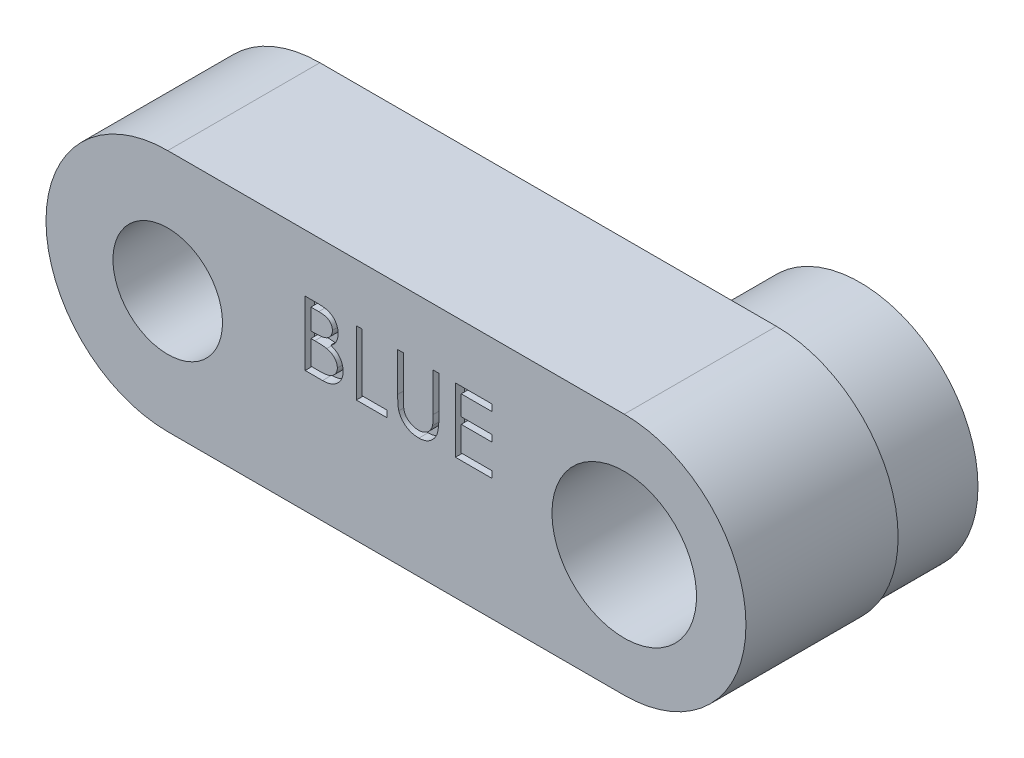
from build123d import *

# Parameters (mm, degrees)
SKETCH1_R           = 1.8
SKETCH1_R_2         = 1.45
BOSS_EXTRUDE1_DEPTH = 2.5
CUT_EXTRUDE2_DEPTH  = 0.3
SKETCH14_R          = 2.375
CUT_EXTRUDE12_DEPTH = 14.162446737
BOSS_EXTRUDE2_START = 2.75
SKETCH17_R          = 3.875
SKETCH17_R_2        = 2.375
BOSS_EXTRUDE2_DEPTH = 2.75
SKETCH18_R          = 2.375
SKETCH18_R_2        = 1.375
BOSS_EXTRUDE3_DEPTH = 0.8


with BuildPart() as part:
    # Sketch1 → Boss-Extrude1 (new, symmetric)
    with BuildSketch(Plane.XY):
        with BuildLine():
            Line((-7.5, 4), (7.5, 4))
            ThreePointArc((7.5, 4), (11.5, 0), (7.5, -4))
            Line((7.5, -4), (-7.5, -4))
            ThreePointArc((-7.5, -4), (-11.5, 0), (-7.5, 4))
        make_face()
        with Locations((-7.5, 0)):
            Circle(SKETCH1_R, mode=Mode.SUBTRACT)
        with Locations((7.5, 0)):
            Circle(SKETCH1_R_2, mode=Mode.SUBTRACT)
    extrude(amount=BOSS_EXTRUDE1_DEPTH, both=True)

    # Sketch3 → Cut-Extrude2 (cut)
    # profile 1 of 4: a face of its own
    with BuildSketch(Plane.XY.offset(2.5)):
        with BuildLine():
            Line((-2.985042735, 2.116666667), (-2.572055288, 2.116666667))
            add(Edge.make_bspline(
                [(-2.572055288, 2.116666667), (-2.551839018, 2.11656038), (-2.512654855, 2.116354369), (-2.455674526, 2.113159332), (-2.402305007, 2.108802827), (-2.352530821, 2.101890342), (-2.306374968, 2.093549601), (-2.263698349, 2.083448979), (-2.224636674, 2.071337646), (-2.178001828, 2.052078228), (-2.124830762, 2.023458979), (-2.067258401, 1.981168846), (-2.018028218, 1.929442071), (-1.975582207, 1.871093037), (-1.941835816, 1.806906165), (-1.917422002, 1.738411322), (-1.901965573, 1.666491983), (-1.900375996, 1.6171173), (-1.89957265, 1.592164129)],
                knots=[0, 0, 0, 0, 1.001505555, 1.941167018, 2.826882275, 3.653841531, 4.429895133, 5.150066043, 5.825578002, 6.45369114, 7.647487171, 8.808567382, 9.977351308, 11.170798116, 12.373658725, 13.556498008, 14.765093433, 16, 16, 16, 16], degree=3))
            add(Edge.make_bspline(
                [(-1.89957265, 1.592164129), (-1.900233786, 1.568788536), (-1.901532983, 1.522853291), (-1.913956461, 1.455667806), (-1.933406008, 1.391713497), (-1.96044204, 1.331223769), (-1.995579914, 1.275565346), (-2.037222802, 1.224289237), (-2.087464487, 1.179566455), (-2.125106827, 1.154563843), (-2.144227431, 1.141863649)],
                knots=[0, 0, 0, 0, 1.044552857, 2.05264487, 3.044412934, 4.028983338, 5.005914585, 5.980388656, 6.974128949, 8, 8, 8, 8], degree=3))
            add(Edge.make_bspline(
                [(-2.144227431, 1.141863649), (-2.120181839, 1.132631959), (-2.074176665, 1.114969449), (-2.010866552, 1.083742288), (-1.956320146, 1.049777583), (-1.910118063, 1.012686416), (-1.870604338, 0.972706326), (-1.836100892, 0.92925109), (-1.806660252, 0.881753841), (-1.781433865, 0.830709799), (-1.761749617, 0.776640172), (-1.747007999, 0.720052132), (-1.738561018, 0.661148591), (-1.737358968, 0.621061719), (-1.736752137, 0.600824653)],
                knots=[0, 0, 0, 0, 1.27268992, 2.434971085, 3.483601985, 4.442670788, 5.356604649, 6.2567628, 7.179492994, 8.113709626, 9.066344395, 10.018646069, 10.999752585, 12, 12, 12, 12], degree=3))
            add(Edge.make_bspline(
                [(-1.736752137, 0.600824653), (-1.737342896, 0.58016183), (-1.738505231, 0.539507148), (-1.747080738, 0.479783804), (-1.761600531, 0.422709432), (-1.781600701, 0.367914869), (-1.807703624, 0.315506121), (-1.839470536, 0.265423814), (-1.87734772, 0.218171147), (-1.919719074, 0.173223051), (-1.9676538, 0.132808151), (-2.019370471, 0.096815319), (-2.075520388, 0.067214605), (-2.135181356, 0.042349202), (-2.199022633, 0.023355325), (-2.266757543, 0.010067149), (-2.338327668, 0.001113627), (-2.387440232, 0.000377508), (-2.41262687, 0)],
                knots=[0, 0, 0, 0, 0.978564426, 1.925352924, 2.850884081, 3.763762016, 4.682927383, 5.618979971, 6.567305752, 7.547517671, 8.540179244, 9.531824382, 10.526200242, 11.540722885, 12.589160233, 13.674978461, 14.80764778, 16, 16, 16, 16], degree=3))
            Line((-2.41262687, 0), (-2.985042735, 0))
            Line((-2.985042735, 0), (-2.985042735, 2.116666667))
        make_face()
        with BuildLine():
            Line((-2.79508547, 1.89957265), (-2.79508547, 1.221153846))
            Line((-2.79508547, 1.221153846), (-2.667457933, 1.221153846))
            add(Edge.make_bspline(
                [(-2.667457933, 1.221153846), (-2.648801756, 1.221395704), (-2.612754222, 1.221863024), (-2.560551237, 1.223201674), (-2.512094678, 1.226950015), (-2.467468189, 1.230697278), (-2.426742044, 1.236790005), (-2.390006471, 1.244042384), (-2.356684938, 1.251712522), (-2.318258642, 1.264756926), (-2.274671668, 1.28403533), (-2.228205934, 1.313954011), (-2.187242707, 1.349589215), (-2.152652027, 1.390707559), (-2.124342233, 1.435983776), (-2.104679176, 1.484695461), (-2.091345819, 1.535628588), (-2.090141416, 1.570594865), (-2.089529915, 1.588348024)],
                knots=[0, 0, 0, 0, 1.156816544, 2.235205308, 3.236616184, 4.169592532, 5.011045266, 5.787822928, 6.49130361, 7.128639758, 8.301311294, 9.436451833, 10.541879658, 11.654887649, 12.756523258, 13.837046038, 14.901820046, 16, 16, 16, 16], degree=3))
            add(Edge.make_bspline(
                [(-2.089529915, 1.588348024), (-2.089848128, 1.60009599), (-2.090472339, 1.623140909), (-2.095584575, 1.656735043), (-2.104273536, 1.688330074), (-2.11543399, 1.718358988), (-2.131030006, 1.745882821), (-2.149392672, 1.77185323), (-2.17157878, 1.795385797), (-2.196832012, 1.817380684), (-2.225865798, 1.836880946), (-2.258662818, 1.853959884), (-2.295666794, 1.867712639), (-2.336254092, 1.87975717), (-2.381049464, 1.888216757), (-2.429535979, 1.895264282), (-2.482110786, 1.898852178), (-2.518484252, 1.899327136), (-2.537286325, 1.89957265)],
                knots=[0, 0, 0, 0, 0.91205012, 1.789085906, 2.630437955, 3.453916878, 4.269457761, 5.079663411, 5.91843418, 6.774407191, 7.675494373, 8.627863946, 9.638891023, 10.736472738, 11.911756761, 13.175263542, 14.539845004, 16, 16, 16, 16], degree=3))
            Line((-2.537286325, 1.89957265), (-2.79508547, 1.89957265))
        make_face(mode=Mode.SUBTRACT)
        with BuildLine():
            Line((-2.79508547, 1.004059829), (-2.79508547, 0.217094017))
            Line((-2.79508547, 0.217094017), (-2.524565972, 0.217094017))
            add(Edge.make_bspline(
                [(-2.524565972, 0.217094017), (-2.505202146, 0.217326093), (-2.467880923, 0.217773388), (-2.413995893, 0.219233619), (-2.364052778, 0.222555138), (-2.318279477, 0.227783819), (-2.276181727, 0.233455547), (-2.238264544, 0.24108237), (-2.204220565, 0.249820551), (-2.164745151, 0.263327407), (-2.120293029, 0.284310511), (-2.072389321, 0.315948162), (-2.029798227, 0.353638925), (-1.993630284, 0.397260954), (-1.963989096, 0.444693232), (-1.942426035, 0.494976372), (-1.929126803, 0.547279525), (-1.927516824, 0.582940346), (-1.926709402, 0.600824653)],
                knots=[0, 0, 0, 0, 1.160039823, 2.235823828, 3.228722157, 4.157150951, 4.99529583, 5.772374946, 6.472645482, 7.099169577, 8.269452708, 9.405989375, 10.527446681, 11.663510218, 12.788923519, 13.866172445, 14.929861265, 16, 16, 16, 16], degree=3))
            add(Edge.make_bspline(
                [(-1.926709402, 0.600824653), (-1.926876379, 0.612008721), (-1.927207641, 0.634196456), (-1.932203346, 0.66680269), (-1.939468876, 0.698386908), (-1.948861696, 0.729034875), (-1.962541088, 0.758192489), (-1.978510761, 0.786436417), (-1.997235037, 0.813803998), (-2.02641127, 0.848403789), (-2.068848613, 0.888267888), (-2.129147473, 0.92729771), (-2.19771072, 0.958774241), (-2.247438775, 0.972139163), (-2.273127003, 0.979043136)],
                knots=[0, 0, 0, 0, 0.723448775, 1.435228256, 2.130040452, 2.821711965, 3.505591119, 4.210454504, 4.921174351, 5.648778258, 7.137944449, 8.670945889, 10.280296675, 12, 12, 12, 12], degree=3))
            add(Edge.make_bspline(
                [(-2.273127003, 0.979043136), (-2.283425552, 0.981132639), (-2.305754929, 0.985663113), (-2.34216618, 0.99044539), (-2.383735015, 0.994705974), (-2.430557422, 0.997857484), (-2.48269264, 1.00111506), (-2.540252014, 1.002381928), (-2.603000486, 1.003893386), (-2.64653873, 1.004002929), (-2.66915398, 1.004059829)],
                knots=[0, 0, 0, 0, 0.634451884, 1.375622551, 2.216452059, 3.157844607, 4.20941857, 5.370758133, 6.634282058, 8, 8, 8, 8], degree=3))
            Line((-2.66915398, 1.004059829), (-2.79508547, 1.004059829))
        make_face(mode=Mode.SUBTRACT)
    # profile 2 of 4: a face of its own
    with BuildSketch(Plane.XY.offset(2.5)):
        Polygon((-1.302564103, 2.116666667), (-1.112606838, 2.116666667), (-1.112606838, 0.217094017), (-0.298504274, 0.217094017), (-0.298504274, 0), (-1.302564103, 0), align=None)
    # profile 3 of 4: a face of its own
    with BuildSketch(Plane.XY.offset(2.5)):
        with BuildLine():
            Line((0.054273504, 2.116666667), (0.244230769, 2.116666667))
            Line((0.244230769, 2.116666667), (0.244230769, 0.848447516))
            add(Edge.make_bspline(
                [(0.244230769, 0.848447516), (0.2442025, 0.830497738), (0.244148855, 0.79643494), (0.244507185, 0.747952206), (0.245510708, 0.704849338), (0.246143385, 0.66696019), (0.247550868, 0.634458623), (0.248698734, 0.607168554), (0.25017469, 0.585219203), (0.251948528, 0.572409786), (0.252711004, 0.566903713)],
                knots=[0, 0, 0, 0, 1.528628734, 2.90083645, 4.128790002, 5.200304208, 6.127813768, 6.898992206, 7.526736466, 8, 8, 8, 8], degree=3))
            add(Edge.make_bspline(
                [(0.252711004, 0.566903713), (0.255842134, 0.547039241), (0.261927966, 0.508429591), (0.277437918, 0.453451725), (0.299098978, 0.403902701), (0.324766914, 0.358236348), (0.358592826, 0.317723735), (0.399114012, 0.280402879), (0.448207234, 0.247762787), (0.50279341, 0.217917296), (0.561627815, 0.193929365), (0.621747962, 0.175790521), (0.682250145, 0.164736139), (0.722754778, 0.163456137), (0.74286859, 0.162820513)],
                knots=[0, 0, 0, 0, 1.035780045, 2.013197591, 2.933192213, 3.817615948, 4.702609284, 5.640816605, 6.646850145, 7.73207398, 8.84249596, 9.914020372, 10.964143139, 12, 12, 12, 12], degree=3))
            add(Edge.make_bspline(
                [(0.74286859, 0.162820513), (0.760136804, 0.163469937), (0.794573496, 0.164765033), (0.845740243, 0.172785041), (0.895572689, 0.187239193), (0.94431691, 0.205889904), (0.990007267, 0.230532495), (1.032669254, 0.258999145), (1.070747442, 0.29238858), (1.105495851, 0.329339741), (1.135755074, 0.371031905), (1.161984288, 0.416557256), (1.183469017, 0.466600908), (1.194078672, 0.501770487), (1.199529247, 0.519838408)],
                knots=[0, 0, 0, 0, 0.994687771, 1.983630487, 2.973142513, 3.978332533, 4.983357753, 5.956394766, 6.925816176, 7.893390482, 8.871859704, 9.88551698, 10.913711441, 12, 12, 12, 12], degree=3))
            add(Edge.make_bspline(
                [(1.199529247, 0.519838408), (1.201343608, 0.527306355), (1.205386737, 0.543947952), (1.209164712, 0.572082256), (1.21309961, 0.605277252), (1.21582985, 0.643771444), (1.218491541, 0.687435842), (1.220083923, 0.736497912), (1.220819938, 0.790779502), (1.221039273, 0.828660071), (1.221153846, 0.848447516)],
                knots=[0, 0, 0, 0, 0.558680831, 1.244966039, 2.062412453, 2.990489873, 4.051219941, 5.244515665, 6.560634259, 8, 8, 8, 8], degree=3))
            Line((1.221153846, 0.848447516), (1.221153846, 2.116666667))
            Line((1.221153846, 2.116666667), (1.411111111, 2.116666667))
            Line((1.411111111, 2.116666667), (1.411111111, 0.838271234))
            add(Edge.make_bspline(
                [(1.411111111, 0.838271234), (1.410957429, 0.815230786), (1.410657508, 0.77026595), (1.408056684, 0.704376319), (1.403909831, 0.641872373), (1.398050845, 0.582745711), (1.390287514, 0.52720791), (1.381654405, 0.474772169), (1.370660116, 0.425814883), (1.357818963, 0.379954326), (1.343139246, 0.336299277), (1.324124838, 0.294867877), (1.30270145, 0.254400597), (1.277292588, 0.215509502), (1.248740942, 0.178022397), (1.216415402, 0.142166623), (1.181385076, 0.107369199), (1.143067628, 0.074522726), (1.102094692, 0.044400336), (1.058588146, 0.017913112), (1.012882194, -0.004477361), (0.965095647, -0.022908039), (0.91520811, -0.036765916), (0.863218326, -0.04709232), (0.809007956, -0.0529599), (0.772138855, -0.053831924), (0.753468884, -0.054273504)],
                knots=[0, 0, 0, 0, 1.316592851, 2.569410997, 3.76748051, 4.895814652, 5.963796859, 6.97159953, 7.931736103, 8.829262218, 9.692595152, 10.560224239, 11.431080259, 12.30701507, 13.211635791, 14.121146779, 15.063487852, 16.031507147, 17.00238618, 17.966455255, 18.938106653, 19.907068911, 20.888905087, 21.893141452, 22.933117798, 24, 24, 24, 24], degree=3))
            add(Edge.make_bspline(
                [(0.753468884, -0.054273504), (0.733107093, -0.053798908), (0.693157333, -0.052867752), (0.634290978, -0.047532089), (0.577858106, -0.037481917), (0.523262695, -0.024685189), (0.471248033, -0.007035977), (0.421117235, 0.01358527), (0.37372889, 0.038911042), (0.328314217, 0.067088951), (0.286086864, 0.098793375), (0.247323197, 0.133349575), (0.211959218, 0.170203994), (0.180591006, 0.209755644), (0.152698852, 0.251696914), (0.128671533, 0.296146455), (0.108041142, 0.343087055), (0.097393361, 0.375715896), (0.09201055, 0.392210871)],
                knots=[0, 0, 0, 0, 1.13879206, 2.234305948, 3.301075583, 4.341971843, 5.366689343, 6.369221514, 7.369726634, 8.367512178, 9.355451585, 10.318319045, 11.268648973, 12.207971039, 13.137398894, 14.081662264, 15.030215811, 16, 16, 16, 16], degree=3))
            add(Edge.make_bspline(
                [(0.09201055, 0.392210871), (0.088879602, 0.403479142), (0.082088506, 0.427920273), (0.074816064, 0.468370673), (0.068702477, 0.514946362), (0.062953877, 0.567650526), (0.059561793, 0.626524017), (0.056587914, 0.691541314), (0.054252554, 0.762781033), (0.054266326, 0.812404478), (0.054273504, 0.838271234)],
                knots=[0, 0, 0, 0, 0.625038921, 1.35572334, 2.194682327, 3.136881307, 4.189498639, 5.346923369, 6.617055217, 8, 8, 8, 8], degree=3))
            Line((0.054273504, 0.838271234), (0.054273504, 2.116666667))
        make_face()
    # profile 4 of 4: a face of its own
    with BuildSketch(Plane.XY.offset(2.5)):
        Polygon((1.953846154, 2.116666667), (3.147863248, 2.116666667), (3.147863248, 1.89957265), (2.143803419, 1.89957265), (2.143803419, 1.248290598), (3.147863248, 1.248290598), (3.147863248, 1.031196581), (2.143803419, 1.031196581), (2.143803419, 0.217094017), (3.147863248, 0.217094017), (3.147863248, 0), (1.953846154, 0), align=None)
    extrude(amount=-CUT_EXTRUDE2_DEPTH, mode=Mode.SUBTRACT)

    # Sketch14 → Cut-Extrude12 (cut, through all)
    with BuildSketch(Plane(origin=(0, 0, -2.5), x_dir=(-1, 0, 0), z_dir=(0, 0, -1))):
        with Locations((-7.5, 0)):
            Circle(SKETCH14_R)
    extrude(amount=-CUT_EXTRUDE12_DEPTH, mode=Mode.SUBTRACT)

    # Sketch17 → Boss-Extrude2 (add)
    with BuildSketch(Plane(origin=(0, 0, -2.5), x_dir=(-1, 0, 0), z_dir=(0, 0, -1)).offset(BOSS_EXTRUDE2_START)):
        with Locations((-7.5, 0)):
            Circle(SKETCH17_R)
        with Locations((-7.5, 0)):
            Circle(SKETCH17_R_2, mode=Mode.SUBTRACT)
    extrude(amount=-BOSS_EXTRUDE2_DEPTH)

    # Sketch18 → Boss-Extrude3 (add)
    with BuildSketch(Plane(origin=(0, 0, -3.25), x_dir=(-1, 0, 0), z_dir=(0, 0, -1))):
        with Locations((-7.5, 0)):
            Circle(SKETCH18_R)
        with Locations((-7.5, 0)):
            Circle(SKETCH18_R_2, mode=Mode.SUBTRACT)
    extrude(amount=-BOSS_EXTRUDE3_DEPTH)


solid = part.part
